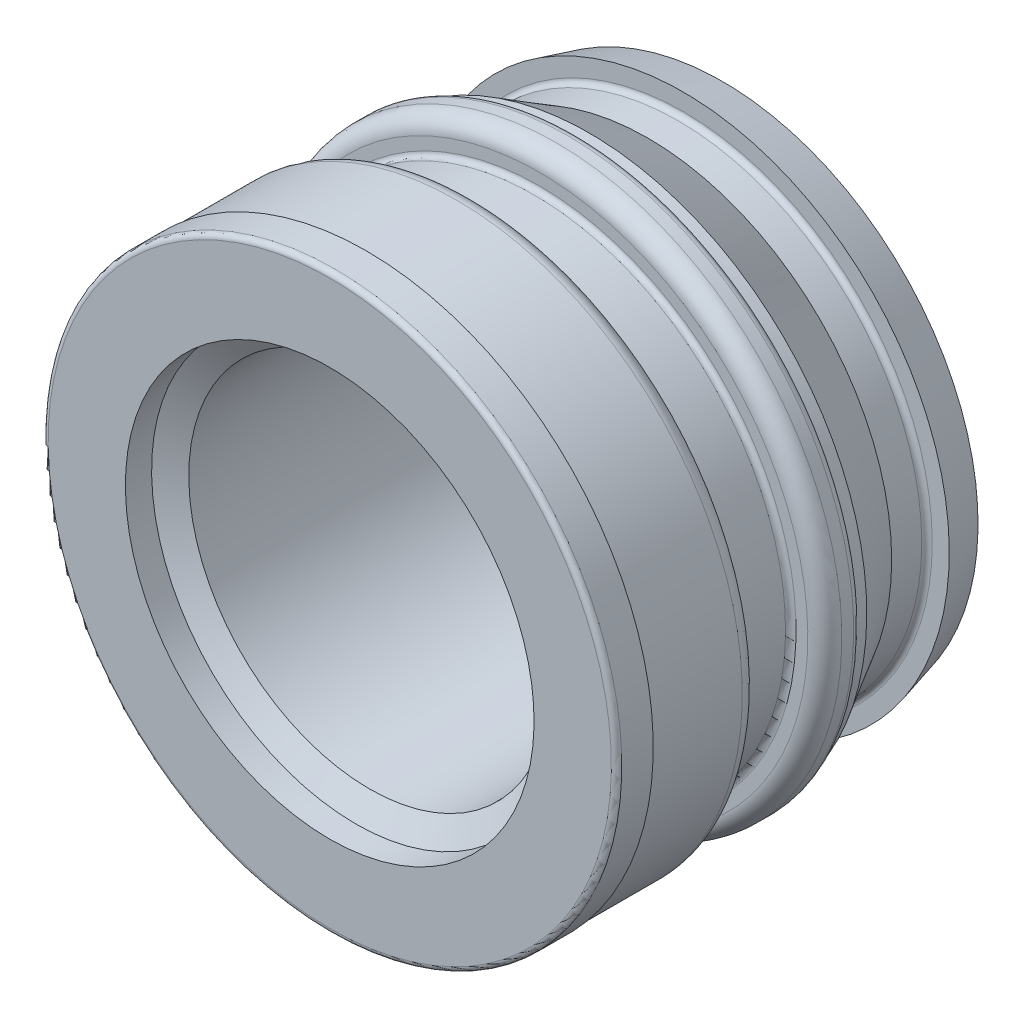
from build123d import *


with BuildPart() as part:
    # Sketch2 → Revolve1 (revolve)
    with BuildSketch(Plane(origin=(0, 0, 0), x_dir=(0, 0, -1), z_dir=(1, 0, 0))):
        with BuildLine():
            Line((0.6096, 2.6924), (1.181523177, 2.3622))
            Line((1.181523177, 2.3622), (1.4732, 2.3622))
            ThreePointArc((1.4732, 2.3622), (1.509121024, 2.377078976), (1.524, 2.413))
            Line((1.524, 2.413), (1.524, 2.5781))
            Line((1.524, 2.5781), (1.905, 2.476011358))
            Line((1.905, 2.476011358), (1.905, 1.9812))
            Line((1.905, 1.9812), (1.6764, 1.7526))
            Line((1.6764, 1.7526), (-1.519017728, 1.7526))
            Line((-1.519017728, 1.7526), (-1.651, 1.9812))
            Line((-1.651, 1.9812), (-1.905, 1.9812))
            Line((-1.905, 1.9812), (-1.905, 2.7305))
            ThreePointArc((-1.905, 2.7305), (-1.890121024, 2.766421024), (-1.8542, 2.7813))
            Line((-1.8542, 2.7813), (-1.5494, 2.7813))
            Line((-1.5494, 2.7813), (-1.5494, 2.7686))
            Line((-1.5494, 2.7686), (-0.6731, 2.7686))
            ThreePointArc((-0.6731, 2.7686), (-0.55635667, 2.72024333), (-0.508, 2.6035))
            Line((-0.508, 2.6035), (-0.508, 2.4892))
            ThreePointArc((-0.508, 2.4892), (-0.493121024, 2.453278976), (-0.4572, 2.4384))
            Line((-0.4572, 2.4384), (0.0762, 2.4384))
            ThreePointArc((0.0762, 2.4384), (0.112121024, 2.453278976), (0.127, 2.4892))
            Line((0.127, 2.4892), (0.127, 2.6035))
            ThreePointArc((0.127, 2.6035), (0.17535667, 2.72024333), (0.2921, 2.7686))
            Line((0.2921, 2.7686), (0.4064, 2.7686))
            ThreePointArc((0.4064, 2.7686), (0.460281537, 2.746281537), (0.4826, 2.6924))
            Line((0.4826, 2.6924), (0.6096, 2.6924))
        make_face()
    revolve(axis=Axis((0, 0, 1.905), (0, 0, -1)))


solid = part.part
